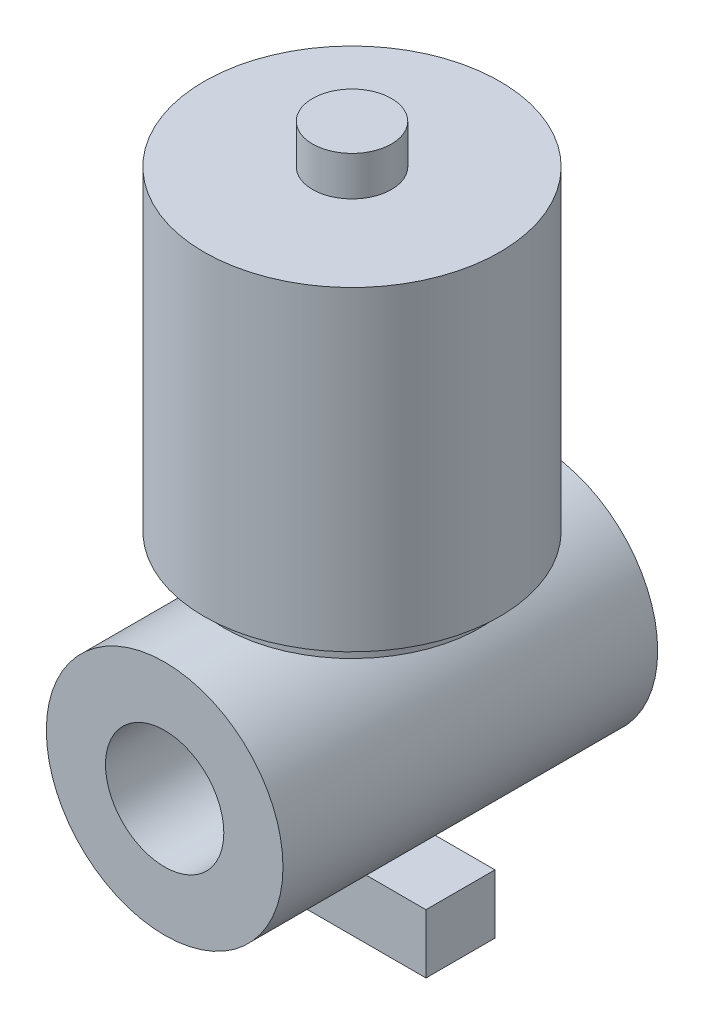
from build123d import *

# Parameters (mm, degrees)
SKETCH2_R                = 15
BOSS_EXTRUDE1_DEPTH      = 32
SKETCH3_R                = 4
BOSS_EXTRUDE2_DEPTH      = 4
SKETCH4_R                = 13
BOSS_EXTRUDE3_DEPTH      = 2
BOSS_EXTRUDE4_DEPTH      = 19
BOSS_EXTRUDE4_DEPTH_BACK = 19
SKETCH10_R               = 6
CUT_EXTRUDE1_DEPTH       = 44.382023927
SKETCH12_R               = 6
CUT_EXTRUDE2_DEPTH       = 55.45181356
BOSS_EXTRUDE5_DEPTH      = 3.5
BOSS_EXTRUDE5_DEPTH_BACK = 3.5
SKETCH14_R               = 2
CUT_EXTRUDE3_DEPTH       = 3
SKETCH16_R               = 2
CUT_EXTRUDE4_DEPTH       = 3


with BuildPart() as part:
    # Sketch2 → Boss-Extrude1 (new body)
    with BuildSketch(Plane(origin=(0, 0, 0), x_dir=(1, 0, 0), z_dir=(0, 1, 0))):
        Circle(SKETCH2_R)
    extrude(amount=BOSS_EXTRUDE1_DEPTH)

    # Sketch3 → Boss-Extrude2 (add)
    with BuildSketch(Plane(origin=(0, 32, 0), x_dir=(1, 0, 0), z_dir=(0, 1, 0))):
        Circle(SKETCH3_R)
    extrude(amount=BOSS_EXTRUDE2_DEPTH)

    # Sketch4 → Boss-Extrude3 (add)
    with BuildSketch(Plane(origin=(0, 0, 0), x_dir=(-1, 0, 0), z_dir=(0, -1, 0))):
        Circle(SKETCH4_R)
    extrude(amount=BOSS_EXTRUDE3_DEPTH)


with BuildPart() as body_2:
    # Sketch6 → Boss-Extrude4 (new, two sides: drawn at the far end of the back side and taken through both)
    with BuildSketch(Plane(origin=(0, 0, 0), x_dir=(-1, 0, 0), z_dir=(0, 0, 1)).offset(-BOSS_EXTRUDE4_DEPTH_BACK)):
        with BuildLine():
            ThreePointArc((0, 2), (8.485281374, 5.514718626), (12, 14))
            ThreePointArc((12, 14), (-8.485281374, 22.485281374), (0, 2))
        make_face()
    extrude(amount=BOSS_EXTRUDE4_DEPTH + BOSS_EXTRUDE4_DEPTH_BACK)

    # Sketch10 → Cut-Extrude1 (cut, through all)
    with BuildSketch(Plane(origin=(0, 0, 0), x_dir=(-1, 0, 0), z_dir=(0, 0, 1))):
        with Locations((0, 14)):
            Circle(SKETCH10_R)
    extrude(amount=-CUT_EXTRUDE1_DEPTH, mode=Mode.SUBTRACT)

    # Sketch12 → Cut-Extrude2 (cut, through all)
    with BuildSketch(Plane.XY.offset(19)):
        with Locations((0, -14)):
            Circle(SKETCH12_R)
    extrude(amount=-CUT_EXTRUDE2_DEPTH, mode=Mode.SUBTRACT)


with BuildPart() as body_3:
    # Sketch13 → Boss-Extrude5 (new, two sides: drawn at the far end of the back side and taken through both)
    with BuildSketch(Plane(origin=(0, 0, 0), x_dir=(-1, 0, 0), z_dir=(0, 0, 1)).offset(-BOSS_EXTRUDE5_DEPTH_BACK)):
        Polygon((11, 26), (11, 32), (-11, 32), (-11, 26), (0, 26), align=None)
    extrude(amount=BOSS_EXTRUDE5_DEPTH + BOSS_EXTRUDE5_DEPTH_BACK)

    # Sketch14 → Cut-Extrude3 (cut)
    with BuildSketch(Plane(origin=(0, -32, 0), x_dir=(-1, 0, 0), z_dir=(0, -1, 0))):
        with Locations((-6, 0)):
            Circle(SKETCH14_R)
    extrude(amount=-CUT_EXTRUDE3_DEPTH, mode=Mode.SUBTRACT)

    # Sketch16 → Cut-Extrude4 (cut)
    with BuildSketch(Plane(origin=(0, -32, 0), x_dir=(-1, 0, 0), z_dir=(0, -1, 0))):
        with Locations((6, 0)):
            Circle(SKETCH16_R)
    extrude(amount=-CUT_EXTRUDE4_DEPTH, mode=Mode.SUBTRACT)


solid = Compound([part.part, body_2.part, body_3.part])
